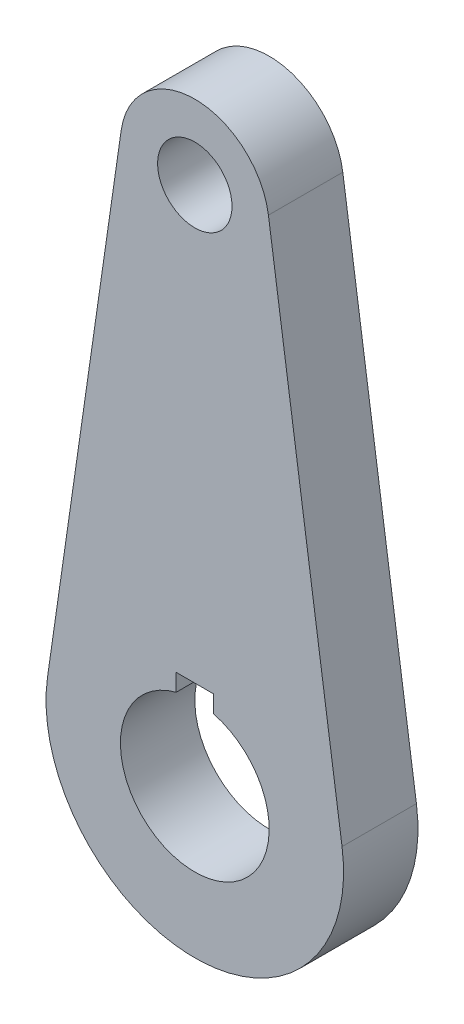
from build123d import *

# Parameters (mm, degrees)
SKETCH2_R           = 5
BOSS_EXTRUDE1_DEPTH = 10
SKETCH3_R           = 10
SKETCH3_R_2         = 5
BOSS_EXTRUDE2_DEPTH = 76.2
BOSS_EXTRUDE3_START = 86.2
SKETCH2_2_R         = 5
BOSS_EXTRUDE3_DEPTH = 22
SKETCH5_R           = 65
BOSS_EXTRUDE4_DEPTH = 22
SKETCH6_R           = 55
CUT_EXTRUDE1_DEPTH  = 22
SKETCH7_R           = 80
CUT_EXTRUDE2_DEPTH  = 143.366569109


with BuildPart() as part:
    # Sketch2 → Boss-Extrude1 (new body)
    with BuildSketch(Plane.XY):
        with BuildLine():
            Line((-19.794866372, 2.857142857), (-9.897433186, 71.428571429))
            ThreePointArc((-9.897433186, 71.428571429), (0, 80), (9.897433186, 71.428571429))
            Line((9.897433186, 71.428571429), (19.794866372, 2.857142857))
            ThreePointArc((19.794866372, 2.857142857), (0, -20), (-19.794866372, 2.857142857))
        make_face()
        with Locations((0, 70)):
            Circle(SKETCH2_R, mode=Mode.SUBTRACT)
        with BuildLine():
            Line((-2.5, 9.682458366), (-2.5, 12))
            Line((-2.5, 12), (2.5, 12))
            Line((2.5, 12), (2.5, 9.682458366))
            ThreePointArc((2.5, 9.682458366), (0, -10), (-2.5, 9.682458366))
        make_face(mode=Mode.SUBTRACT)
    extrude(amount=BOSS_EXTRUDE1_DEPTH)

    # Sketch3 → Boss-Extrude2 (add)
    with BuildSketch(Plane.XY.offset(10)):
        with Locations(Location((0, 70, 0), (0, 0, 171.786789298))):
            Circle(SKETCH3_R)
        with Locations((0, 70)):
            Circle(SKETCH3_R_2, mode=Mode.SUBTRACT)
    extrude(amount=BOSS_EXTRUDE2_DEPTH)

    # Sketch2<2> → Boss-Extrude3 (add)
    with BuildSketch(Plane.XY.offset(BOSS_EXTRUDE3_START)):
        with BuildLine():
            Line((-19.794866372, 2.857142857), (-9.897433186, 71.428571429))
            ThreePointArc((-9.897433186, 71.428571429), (0, 80), (9.897433186, 71.428571429))
            Line((9.897433186, 71.428571429), (19.794866372, 2.857142857))
            ThreePointArc((19.794866372, 2.857142857), (0, -20), (-19.794866372, 2.857142857))
        make_face()
        with Locations((0, 70)):
            Circle(SKETCH2_2_R, mode=Mode.SUBTRACT)
        with BuildLine():
            Line((-2.5, 9.682458366), (-2.5, 12))
            Line((-2.5, 12), (2.5, 12))
            Line((2.5, 12), (2.5, 9.682458366))
            ThreePointArc((2.5, 9.682458366), (0, -10), (-2.5, 9.682458366))
        make_face(mode=Mode.SUBTRACT)
    extrude(amount=BOSS_EXTRUDE3_DEPTH)

    # Sketch5 → Boss-Extrude4 (add)
    with BuildSketch(Plane.XY.offset(108.2)):
        Circle(SKETCH5_R)
    extrude(amount=-BOSS_EXTRUDE4_DEPTH)

    # Sketch6 → Cut-Extrude1 (cut)
    with BuildSketch(Plane.XY.offset(108.2)):
        Circle(SKETCH6_R)
    extrude(amount=-CUT_EXTRUDE1_DEPTH, mode=Mode.SUBTRACT)

    # Sketch7 → Cut-Extrude2 (cut, through all)
    with BuildSketch(Plane.XY.offset(10)):
        Circle(SKETCH7_R)
    extrude(amount=CUT_EXTRUDE2_DEPTH, mode=Mode.SUBTRACT)


solid = part.part
